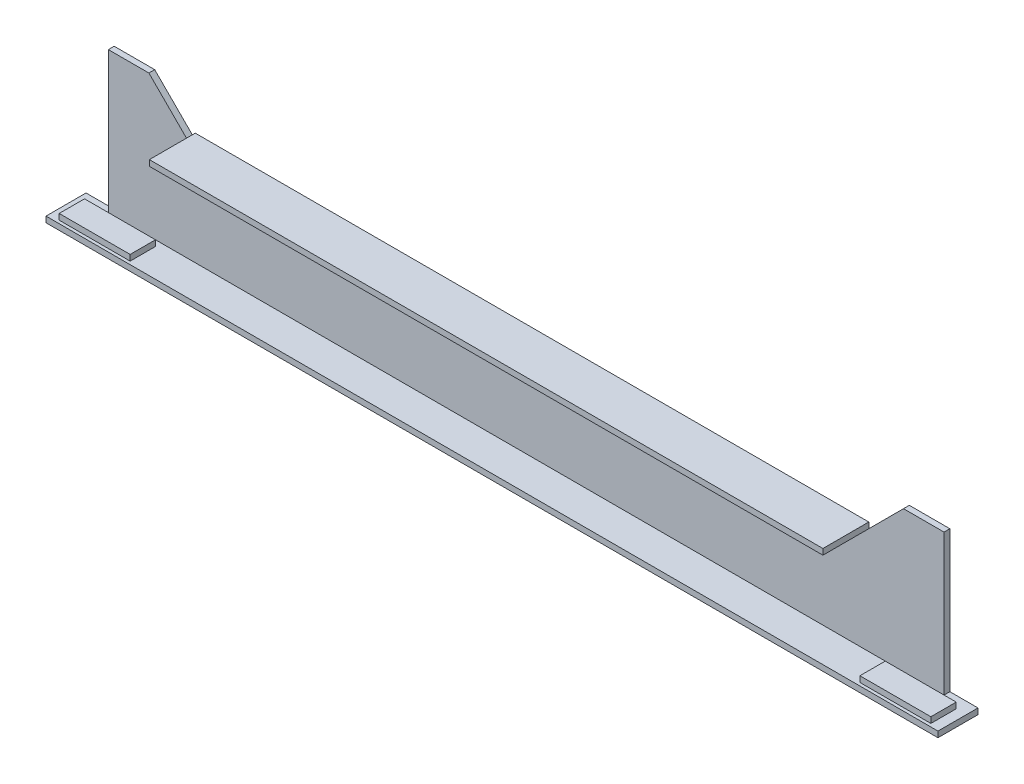
from build123d import *

# Parameters (mm, degrees)
EXTRUDE_562_DEPTH    = 11.5
EXTRUDE_7_DEPTH      = 79
EXTRUDE_7_DEPTH_BACK = 11.5
SKETCH_2_W           = 1329
SKETCH_2_H           = 11.5
EXTRUDE_9_DEPTH      = 67.5
EXTRUDE_9_DEPTH_BACK = 11.5
SKETCH_3_W           = 1760
SKETCH_3_H           = 11.5
SKETCH_4_W           = 140
SKETCH_4_H           = 50
EXTRUDE_10_DEPTH     = 11.5


with BuildPart() as part:
    # 草图1 → Extrude 562 (new body)
    with BuildSketch(Plane.XY):
        Polygon((-744.5, 139.25), (-664.5, 59.25), (664.5, 59.25), (744.5, 139.25), (824.5, 139.25), (824.5, -139.25), (-824.5, -139.25), (-824.5, 139.25), align=None)
    extrude(amount=EXTRUDE_562_DEPTH)

    # 草图2 → 凸台-拉伸7 (add, two sides: drawn at the far end of the back side and taken through both)
    with BuildSketch(Plane.XY.offset(11.5).offset(-EXTRUDE_7_DEPTH_BACK)):
        with Locations((0, 65)):
            Rectangle(SKETCH_2_W, SKETCH_2_H)
    extrude(amount=EXTRUDE_7_DEPTH + EXTRUDE_7_DEPTH_BACK)

    # 草图3 → 凸台-拉伸9 (add, two sides: drawn at the far end of the back side and taken through both)
    with BuildSketch(Plane.XY.offset(11.5).offset(-EXTRUDE_9_DEPTH_BACK)):
        with Locations((0, -145)):
            Rectangle(SKETCH_3_W, SKETCH_3_H)
    extrude(amount=EXTRUDE_9_DEPTH + EXTRUDE_9_DEPTH_BACK)

    # 草图4 → 凸台-拉伸10 (add)
    with BuildSketch(Plane(origin=(0, -139.25, 0), x_dir=(-1, 0, 0), z_dir=(0, 1, 0))):
        with Locations((-790, 48)):
            Rectangle(SKETCH_4_W, SKETCH_4_H)
        with Locations((790, 48)):
            Rectangle(SKETCH_4_W, SKETCH_4_H)
    extrude(amount=EXTRUDE_10_DEPTH)


solid = part.part
